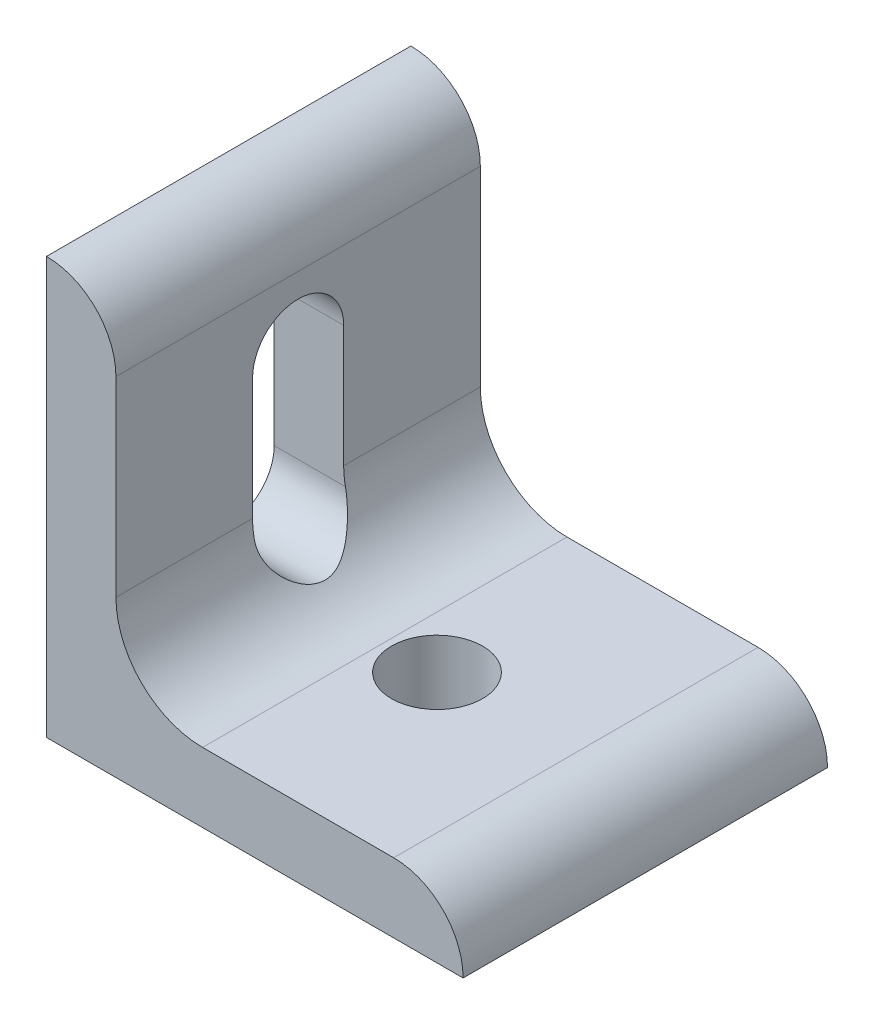
from build123d import *

# Parameters (mm, degrees)
BOSS_EXTRUDE1_DEPTH      = 16.6624
BOSS_EXTRUDE1_DEPTH_BACK = 16.6624
CUT_EXTRUDE1_DEPTH       = 41.602962623
CUT_EXTRUDE1_DEPTH_BACK  = 41.602962623
SKETCH6_R                = 4.1656
CUT_EXTRUDE2_DEPTH       = 41.602962711


with BuildPart() as part:
    # Sketch4 → Boss-Extrude1 (new, two sides: drawn at the far end of the back side and taken through both)
    with BuildSketch(Plane.XY.offset(-BOSS_EXTRUDE1_DEPTH_BACK)):
        with BuildLine():
            Line((-19.05, 19.05), (-19.05, -19.05))
            Line((-19.05, -19.05), (19.05, -19.05))
            ThreePointArc((19.05, -19.05), (17.190128061, -14.559871939), (12.7, -12.7))
            Line((12.7, -12.7), (-4.7752, -12.7))
            ThreePointArc((-4.7752, -12.7), (-10.37887982, -10.37887982), (-12.7, -4.7752))
            Line((-12.7, -4.7752), (-12.7, 12.7))
            ThreePointArc((-12.7, 12.7), (-14.559871939, 17.190128061), (-19.05, 19.05))
        make_face()
    extrude(amount=BOSS_EXTRUDE1_DEPTH + BOSS_EXTRUDE1_DEPTH_BACK)

    # Sketch5 → Cut-Extrude1 (cut, two sides: drawn at the far end of the back side and taken through both)
    with BuildSketch(Plane(origin=(-12.7, 0, 0), x_dir=(0, 0, -1), z_dir=(1, 0, 0)).offset(-CUT_EXTRUDE1_DEPTH_BACK)):
        with BuildLine():
            Line((4.1656, 6.35), (4.1656, -6.35))
            ThreePointArc((4.1656, -6.35), (0, -10.5156), (-4.1656, -6.35))
            Line((-4.1656, -6.35), (-4.1656, 6.35))
            ThreePointArc((-4.1656, 6.35), (0, 10.5156), (4.1656, 6.35))
        make_face()
    extrude(amount=CUT_EXTRUDE1_DEPTH + CUT_EXTRUDE1_DEPTH_BACK, mode=Mode.SUBTRACT)

    # Sketch6 → Cut-Extrude2 (cut, through all)
    with BuildSketch(Plane(origin=(0, -12.7, 0), x_dir=(1, 0, 0), z_dir=(0, 1, 0))):
        with Locations(Location((0, 0, 0), (0, 0, 180))):
            Circle(SKETCH6_R)
    extrude(amount=-CUT_EXTRUDE2_DEPTH, mode=Mode.SUBTRACT)


solid = part.part
